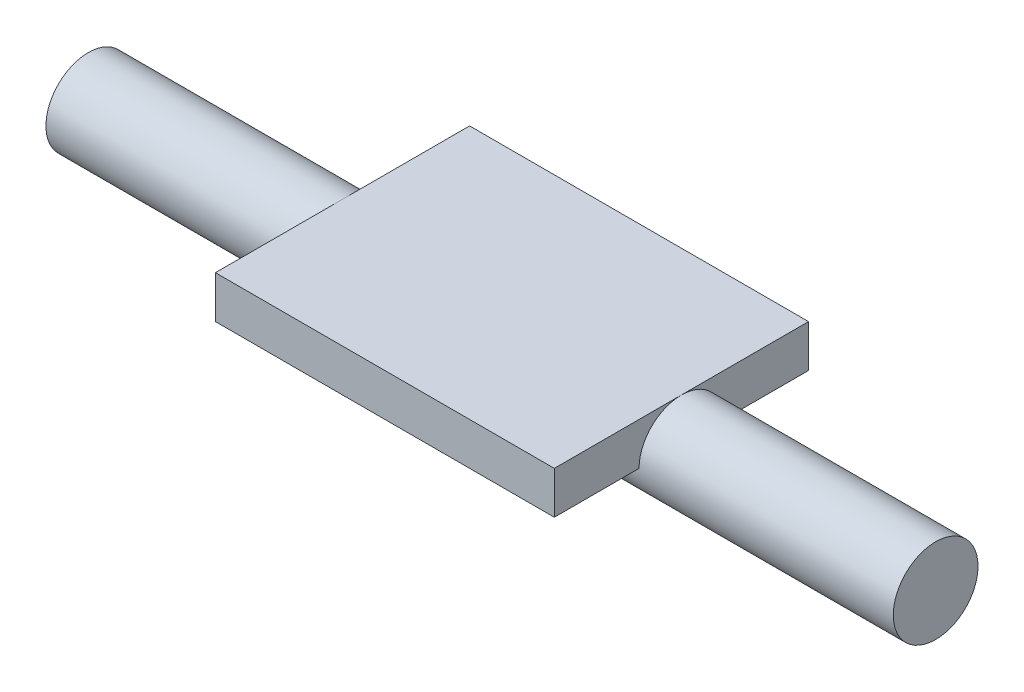
from build123d import *

# Parameters (mm, degrees)
SKETCH_2_R          = 2.5
EXTRUDE_1_DEPTH     = 50
CUT_EXTRUDE_START   = -15
CUT_EXTRUDE_1_DEPTH = 20
SKETCH_5_W          = 20
SKETCH_5_H          = 15
EXTRUDE_2_DEPTH     = 2.5


with BuildPart() as part:
    # 草图2 → 凸台-拉伸1 (new body)
    with BuildSketch(Plane(origin=(0, 0, 0), x_dir=(0, 0, -1), z_dir=(1, 0, 0))):
        Circle(SKETCH_2_R)
    extrude(amount=-EXTRUDE_1_DEPTH)

    # 草图4 → 切除-拉伸1 (cut)
    with BuildSketch(Plane(origin=(0, 0, 0), x_dir=(0, 0, -1), z_dir=(1, 0, 0)).offset(CUT_EXTRUDE_START)):
        with BuildLine():
            Line((-2.5, 0), (2.5, 0))
            ThreePointArc((2.5, 0), (0, 2.5), (-2.5, 0))
        make_face()
    extrude(amount=-CUT_EXTRUDE_1_DEPTH, mode=Mode.SUBTRACT)

    # 草图5 → 凸台-拉伸2 (add)
    with BuildSketch(Plane(origin=(0, 0, 0), x_dir=(1, 0, 0), z_dir=(0, 1, 0))):
        with Locations((-25, 0)):
            Rectangle(SKETCH_5_W, SKETCH_5_H)
    extrude(amount=EXTRUDE_2_DEPTH)


solid = part.part
